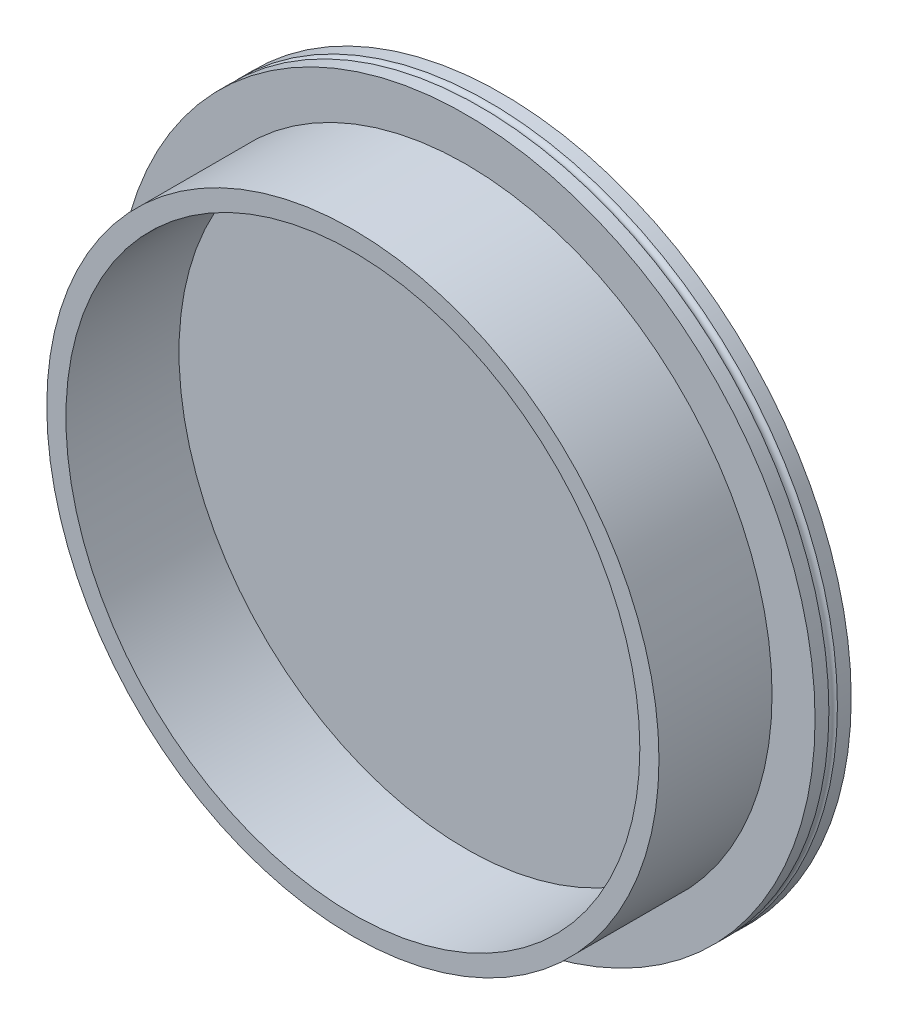
from build123d import *


with BuildPart() as part:
    # Sketch1 → Base-Revolve (revolve)
    with BuildSketch(Plane(origin=(0, 0, 0), x_dir=(0, 0, -1), z_dir=(1, 0, 0))):
        with BuildLine():
            Line((-4.585786438, 115.874999992), (0, 115.874999992))
            Line((0, 115.874999992), (0, 113.374999974))
            Line((0, 113.374999974), (-2, 113.374999974))
            Line((-2, 113.374999974), (-2, 107.374999974))
            Line((-2, 107.374999974), (0, 107.374999974))
            Line((0, 107.374999974), (0, 0))
            Line((0, 0), (-12, 0))
            Line((-12, 0), (-12, 95.25))
            Line((-12, 95.25), (-49.538490201, 95.25))
            Line((-49.538490201, 95.25), (-49.538490201, 101.6))
            Line((-49.538490201, 101.6), (-12, 101.6))
            Line((-12, 101.6), (-12, 115.874999992))
            Line((-12, 115.874999992), (-7.414213562, 115.874999992))
            ThreePointArc((-7.414213562, 115.874999992), (-6, 114.874999992), (-4.585786438, 115.874999992))
        make_face()
    revolve(axis=Axis((0, 0, 12), (0, 0, -1)))


solid = part.part
